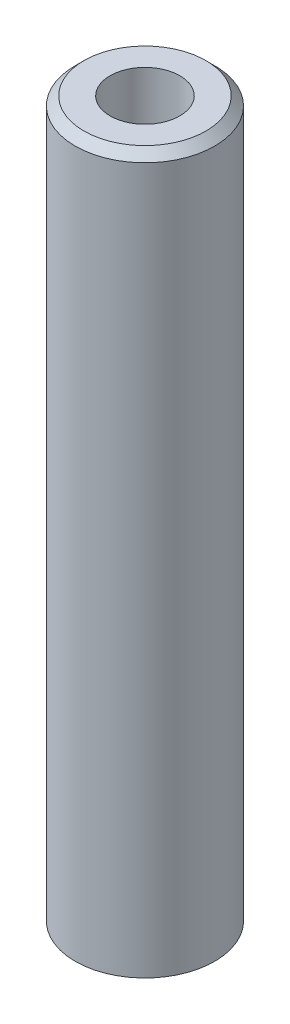
from build123d import *

# Parameters (mm, degrees)
SKETCH1_R           = 4
SKETCH1_R_2         = 2
BOSS_EXTRUDE1_DEPTH = 41
CHAMFER1_SIZE       = 0.5


with BuildPart() as part:
    # Sketch1 → Boss-Extrude1 (new body)
    with BuildSketch(Plane(origin=(0, 0, 0), x_dir=(1, 0, 0), z_dir=(0, 1, 0))):
        with Locations(Location((0, 0, 0), (0, 0, 270))):
            Circle(SKETCH1_R)
        with Locations(Location((0, 0, 0), (0, 0, 270))):
            Circle(SKETCH1_R_2, mode=Mode.SUBTRACT)
    extrude(amount=BOSS_EXTRUDE1_DEPTH)

    # Chamfer1
    chamfer1_edges = [part.edges().sort_by_distance(p)[0] for p in [
        (0, 41, -4),
    ]]
    chamfer(chamfer1_edges, length=CHAMFER1_SIZE)


solid = part.part
